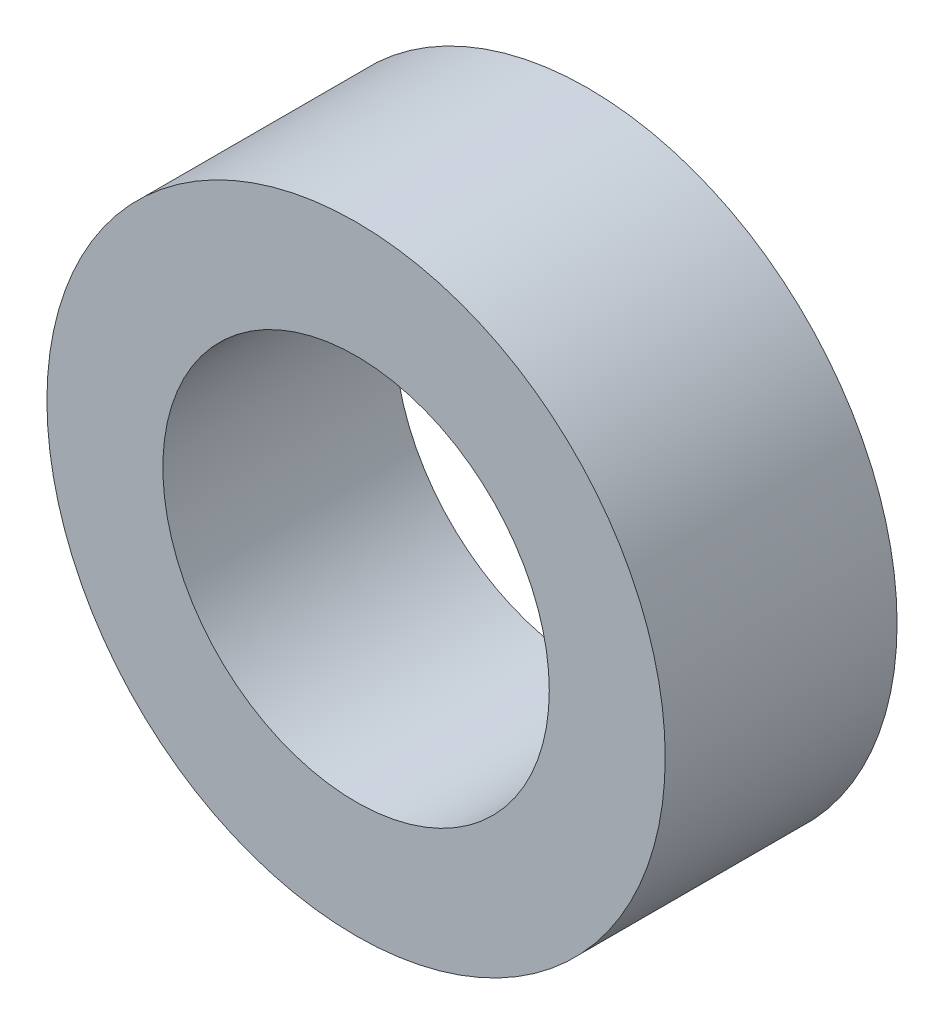
from build123d import *

# Parameters (mm, degrees)
SKETCH_1_R      = 8
SKETCH_1_R_2    = 5
EXTRUDE_1_DEPTH = 6


with BuildPart() as part:
    # 草图1 → 凸台-拉伸1 (new body)
    with BuildSketch(Plane.XY):
        Circle(SKETCH_1_R)
        Circle(SKETCH_1_R_2, mode=Mode.SUBTRACT)
    extrude(amount=EXTRUDE_1_DEPTH)


solid = part.part
